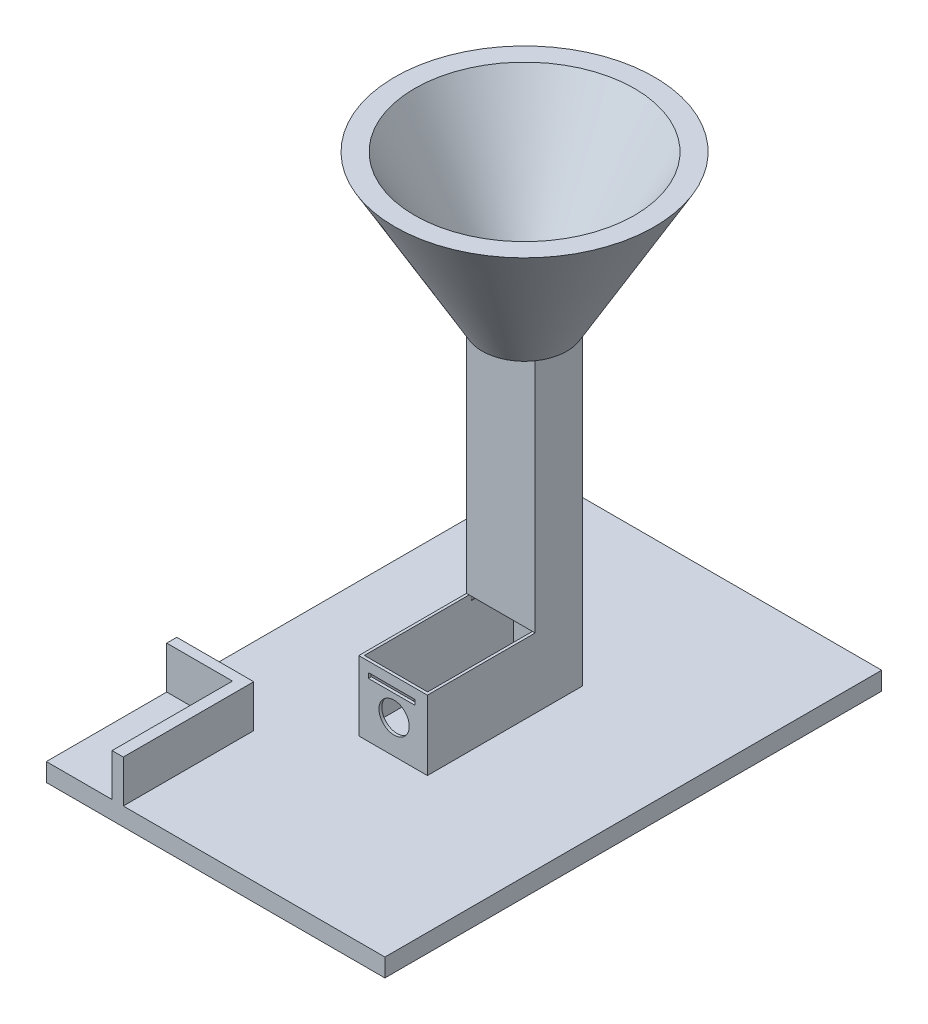
from build123d import *

# Parameters (mm, degrees)
SKETCH2_W            = 22.657552765
SKETCH2_H            = 51.264295363
BOSS_EXTRUDE1_DEPTH  = 2
SKETCH3_W            = 22.657552765
SKETCH3_H            = 51.264295363
SKETCH3_W_2          = 20.905191144
SKETCH3_H_2          = 49.290834071
BOSS_EXTRUDE2_DEPTH  = 21
BOSS_EXTRUDE3_DEPTH  = 78
SKETCH6_W            = 21.285297843
SKETCH6_H            = 14.278933142
CUT_EXTRUDE1_DEPTH   = 80
SKETCH11_R           = 14
BOSS_EXTRUDE4_DEPTH  = 50
BOSS_EXTRUDE4_DRAFT  = -30
SKETCH12_R           = 36.30995568
CUT_EXTRUDE2_DEPTH   = 51
CUT_EXTRUDE2_DRAFT   = -30
SKETCH14_R           = 5
CUT_EXTRUDE4_DEPTH   = 22
SKETCH15_W           = 15.409943134
SKETCH15_H           = 1.668824362
CUT_EXTRUDE5_DEPTH   = 22
SKETCH16_W           = 111.818738814
SKETCH16_H           = 164.067511329
BOSS_EXTRUDE10_DEPTH = 6
BOSS_EXTRUDE11_DEPTH = 14
CUT_EXTRUDE6_DEPTH   = 14


with BuildPart() as part:
    # Sketch2 → Boss-Extrude1 (new body)
    with BuildSketch(Plane(origin=(0, 0, 0), x_dir=(1, 0, 0), z_dir=(0, 1, 0))):
        with Locations((11.328776383, 25.632147682)):
            Rectangle(SKETCH2_W, SKETCH2_H)
    extrude(amount=BOSS_EXTRUDE1_DEPTH)

    # Sketch3 → Boss-Extrude2 (add)
    with BuildSketch(Plane(origin=(0, 2, 0), x_dir=(1, 0, 0), z_dir=(0, 1, 0))):
        with Locations((11.328776383, 25.632147682)):
            Rectangle(SKETCH3_W, SKETCH3_H)
        with Locations((11.328776383, 25.598752808)):
            Rectangle(SKETCH3_W_2, SKETCH3_H_2, mode=Mode.SUBTRACT)
    extrude(amount=BOSS_EXTRUDE2_DEPTH)

    # Sketch5 → Boss-Extrude3 (add)
    with BuildSketch(Plane(origin=(0, 23, 0), x_dir=(1, 0, 0), z_dir=(0, 1, 0))):
        Polygon((22.657552765, 37.450286435), (22.657552765, 51.264295363), (0, 51.264295363), (0, 35.580664168), (22.657552765, 35.580664168), align=None)
    extrude(amount=BOSS_EXTRUDE3_DEPTH)

    # Sketch6 → Cut-Extrude1 (cut)
    with BuildSketch(Plane(origin=(0, 101, 0), x_dir=(1, 0, 0), z_dir=(0, 1, 0))):
        with Locations((11.316093437, 43.486003654)):
            Rectangle(SKETCH6_W, SKETCH6_H)
    extrude(amount=-CUT_EXTRUDE1_DEPTH, mode=Mode.SUBTRACT)


with BuildPart() as boss_extrude4_tool:
    # Sketch11 → Boss-Extrude4 (with draft: the straight prism first)
    with BuildSketch(Plane(origin=(0, 101, 0), x_dir=(1, 0, 0), z_dir=(0, 1, 0))):
        with Locations((11.328776383, 43.422479766)):
            Circle(SKETCH11_R)
    extrude(amount=BOSS_EXTRUDE4_DEPTH)
    # Boss-Extrude4: the draft: its side faces are tilted about the plane it starts from
    boss_extrude4_sides = [boss_extrude4_tool.faces().sort_by_distance(p)[0] for p in [
        (-2.671223617, 126, -43.422479766),
    ]]
    draft(boss_extrude4_sides, Plane(origin=(0, 101, 0), x_dir=(1, 0, 0), z_dir=(0, 1, 0)), BOSS_EXTRUDE4_DRAFT)


with BuildPart() as part_1:
    add(part.part)

    # Boss-Extrude4: add boss_extrude4_tool
    add(boss_extrude4_tool.part)


with BuildPart() as cut_extrude2_tool:
    # Sketch12 → Cut-Extrude2 (with draft: the straight prism first)
    with BuildSketch(Plane(origin=(0, 151, 0), x_dir=(1, 0, 0), z_dir=(0, 1, 0))):
        with Locations((11.328776383, 43.422479766)):
            Circle(SKETCH12_R)
    extrude(amount=-CUT_EXTRUDE2_DEPTH)
    # Cut-Extrude2: the draft: its side faces are tilted about the plane it starts from
    cut_extrude2_sides = [cut_extrude2_tool.faces().sort_by_distance(p)[0] for p in [
        (-24.981179297, 125.5, -43.422479766),
    ]]
    draft(cut_extrude2_sides, Plane(origin=(0, 151, 0), x_dir=(1, 0, 0), z_dir=(0, 1, 0)), CUT_EXTRUDE2_DRAFT)


with BuildPart() as part_2:
    add(part_1.part)

    # Cut-Extrude2: cut by cut_extrude2_tool
    add(cut_extrude2_tool.part, mode=Mode.SUBTRACT)

    # Sketch14 → Cut-Extrude4 (cut)
    with BuildSketch(Plane.XY):
        with Locations((11.657552765, 11.076385635)):
            Circle(SKETCH14_R)
    extrude(amount=-CUT_EXTRUDE4_DEPTH, mode=Mode.SUBTRACT)

    # Sketch15 → Cut-Extrude5 (cut)
    with BuildSketch(Plane.XY):
        with Locations((10.856611193, 18.879859243)):
            Rectangle(SKETCH15_W, SKETCH15_H)
    extrude(amount=-CUT_EXTRUDE5_DEPTH, mode=Mode.SUBTRACT)

    # Sketch16 → Boss-Extrude10 (add)
    with BuildSketch(Plane.XZ):
        with Locations((11.63043448, -23.117453155)):
            Rectangle(SKETCH16_W, SKETCH16_H)
    extrude(amount=BOSS_EXTRUDE10_DEPTH)

    # Sketch17 → Boss-Extrude11 (add)
    with BuildSketch(Plane(origin=(0, 0, 0), x_dir=(1, 0, 0), z_dir=(0, 1, 0))):
        Polygon((-44.278934927, -19.158930428), (-22.558261241, -19.158930428), (-22.558261241, -58.91630251), (-18.859616668, -58.91630251), (-18.859616668, -15.83203433), (-44.278934927, -15.83203433), align=None)
    extrude(amount=BOSS_EXTRUDE11_DEPTH)

    # Sketch18 → Cut-Extrude6 (cut)
    with BuildSketch(Plane(origin=(0, 2, 0), x_dir=(1, 0, 0), z_dir=(0, 1, 0))):
        Polygon((4.238517858, 49.520767008), (19.451065942, 49.052935497), (19.451065942, 47.510847256), (4.238517858, 47.978678766), align=None)
    extrude(amount=-CUT_EXTRUDE6_DEPTH, mode=Mode.SUBTRACT)


solid = part_2.part
